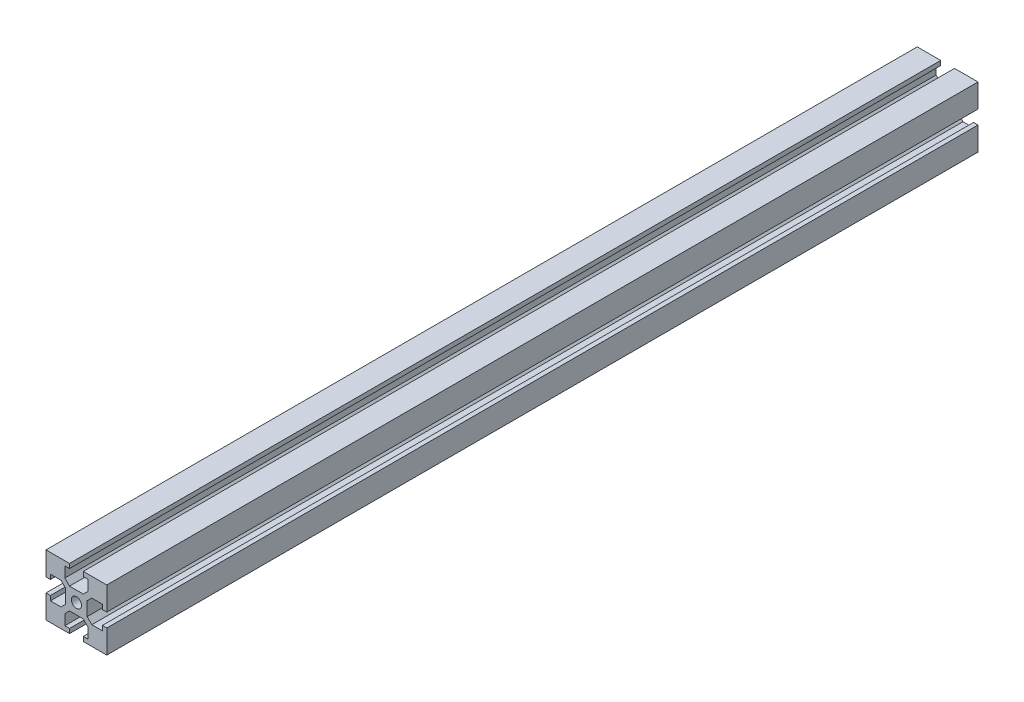
from build123d import *

# Parameters (mm, degrees)
SKETCH_2_R      = 1.25
EXTRUDE_1_DEPTH = 215


with BuildPart() as part:
    # ｽｹｯﾁ2 → ﾎﾞｽ - 押し出し1 (new body)
    with BuildSketch(Plane.XY):
        Polygon((1.7, 2.65), (-1.7, 2.65), (-2.85, 3.8), (-2.85, 6.4), (-1.7, 6.4), (-1.7, 7.5), (-7.5, 7.5), (-7.5, 1.7), (-6.4, 1.7), (-6.4, 2.85), (-3.8, 2.85), (-2.65, 1.7), (-2.65, -1.7), (-3.8, -2.85), (-6.4, -2.85), (-6.4, -1.7), (-7.5, -1.7), (-7.5, -7.5), (-1.7, -7.5), (-1.7, -6.4), (-2.85, -6.4), (-2.85, -3.8), (-1.7, -2.65), (1.7, -2.65), (2.85, -3.8), (2.85, -6.4), (1.7, -6.4), (1.7, -7.5), (7.5, -7.5), (7.5, -1.7), (6.4, -1.7), (6.4, -2.85), (3.8, -2.85), (2.65, -1.7), (2.65, 1.7), (3.8, 2.85), (6.4, 2.85), (6.4, 1.7), (7.5, 1.7), (7.5, 7.5), (1.7, 7.5), (1.7, 6.4), (2.85, 6.4), (2.85, 3.8), align=None)
        Circle(SKETCH_2_R, mode=Mode.SUBTRACT)
    extrude(amount=EXTRUDE_1_DEPTH)


solid = part.part
